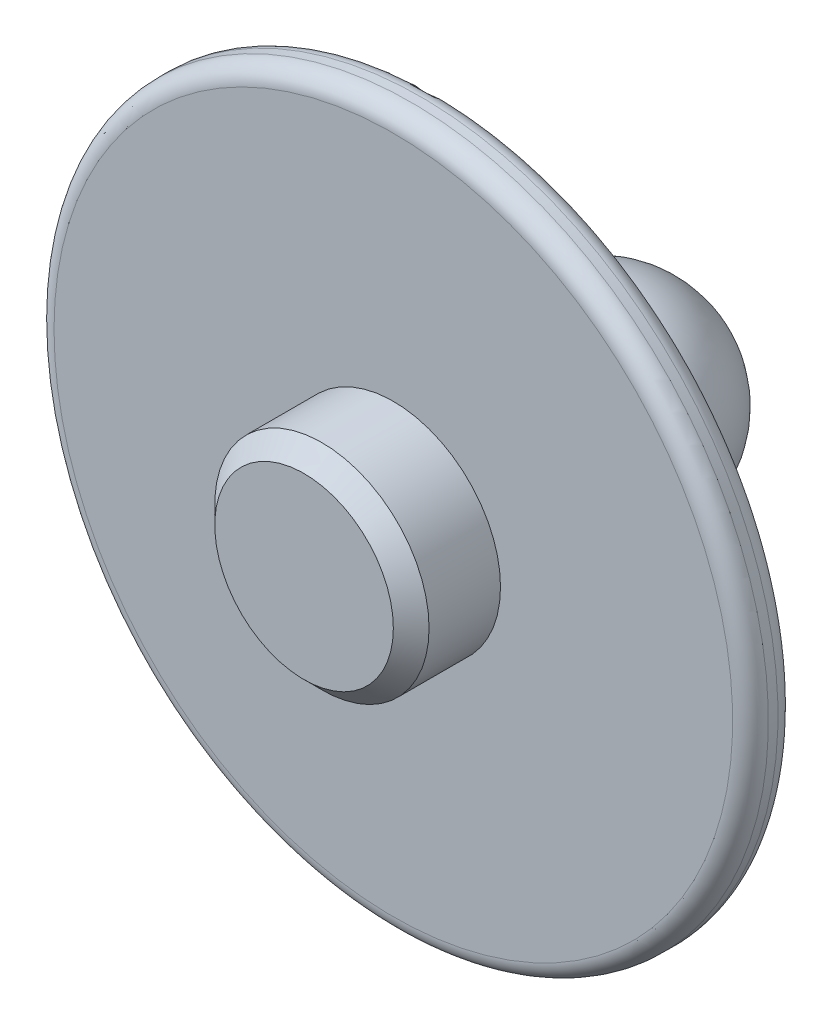
from build123d import *

# Parameters (mm, degrees)
SKETCH_1_R      = 6
EXTRUDE_1_DEPTH = 5
CHAMFER_1_SIZE  = 1
FILLET_1_R      = 1


with BuildPart() as part:
    # 草图1 → 凸台-拉伸1 (new body)
    with BuildSketch(Plane.XY):
        Circle(SKETCH_1_R)
    extrude(amount=EXTRUDE_1_DEPTH)

    # 草图2 → 旋转1 (revolve)
    with BuildSketch(Plane(origin=(0, 0, 0), x_dir=(0, 0, -1), z_dir=(1, 0, 0)), mode=Mode.PRIVATE) as revolve_1_sk:
        with BuildLine():
            Line((0, 0), (0, 20))
            Line((0, 20), (2.174, 20))
            Line((2.174, 20), (8.964324636, 5.437862673))
            ThreePointArc((8.964324636, 5.437862673), (14.723813566, 5.060338535), (17.5, 0))
            Line((17.5, 0), (0, 0))
        make_face()
    revolve(revolve_1_sk.sketch.rotate(Axis((0, 0, 0), (0, 0, -1)), 90), axis=Axis((0, 0, 0), (0, 0, -1)))

    # 倒角1
    chamfer_1_edges = [part.edges().sort_by_distance(p)[0] for p in [
        (-6, 0, 5),
    ]]
    chamfer(chamfer_1_edges, length=CHAMFER_1_SIZE)

    # 圆角1
    fillet_1_edges = [part.edges().sort_by_distance(p)[0] for p in [
        (-20, 0, -2.174),
        (-20, 0, 0),
    ]]
    fillet(fillet_1_edges, radius=FILLET_1_R)


solid = part.part
